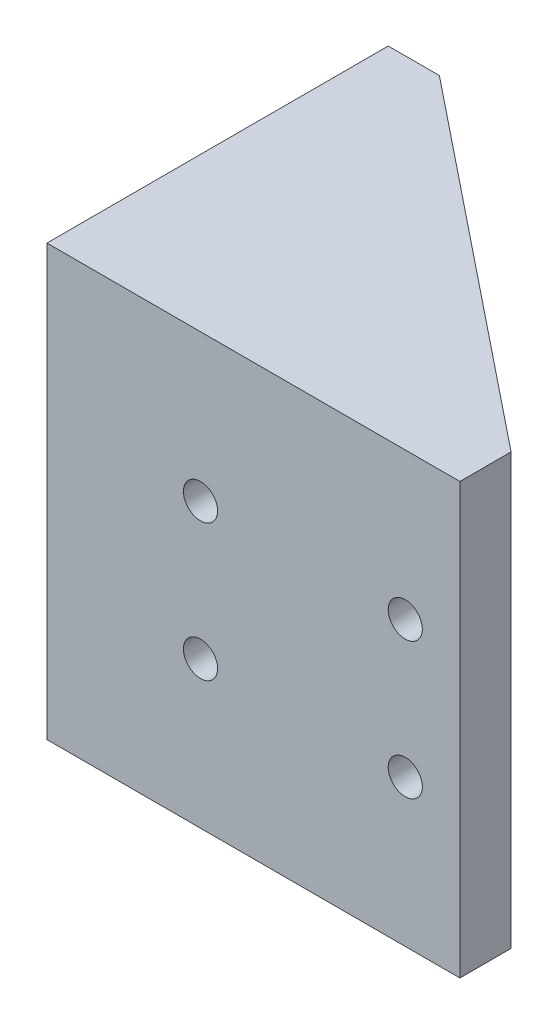
from build123d import *

# Parameters (mm, degrees)
EXTRUDE_1_DEPTH     = 12.6
SKETCH_2_W          = 21.2
SKETCH_2_H          = 20.2
CUT_EXTRUDE_1_DEPTH = 17
SKETCH_3_R          = 1
CUT_EXTRUDE_2_DEPTH = 34.828981658
SKETCH_4_R          = 1.6
CUT_EXTRUDE_3_DEPTH = 32.75216528
FILLET_1_R          = 5
CUT_EXTRUDE_4_DEPTH = 17


with BuildPart() as part:
    # 草图1 → 凸台-拉伸1 (new, symmetric)
    with BuildSketch(Plane(origin=(0, 0, 0), x_dir=(1, 0, 0), z_dir=(0, 1, 0))):
        Polygon((0, 0), (24.2, 0), (24.2, 3), (3, 20), (0, 20), align=None)
    extrude(amount=EXTRUDE_1_DEPTH, both=True)

    # 草图2 → 切除-拉伸1 (cut)
    with BuildSketch(Plane(origin=(0, 0, -20), x_dir=(-1, 0, 0), z_dir=(0, 0, -1))):
        with Locations((-13.6, 0)):
            Rectangle(SKETCH_2_W, SKETCH_2_H)
    extrude(amount=-CUT_EXTRUDE_1_DEPTH, mode=Mode.SUBTRACT)

    # 草图3 → 切除-拉伸2 (cut, through all)
    with BuildSketch(Plane.XY):
        with Locations((21, -4)):
            Circle(SKETCH_3_R)
        with Locations(Location((21, 4, 0), (0, 0, 180))):
            Circle(SKETCH_3_R)
        with Locations((9, 4)):
            Circle(SKETCH_3_R)
        with Locations(Location((9, -4, 0), (0, 0, 180))):
            Circle(SKETCH_3_R)
    extrude(amount=-CUT_EXTRUDE_2_DEPTH, mode=Mode.SUBTRACT)

    # 草图4 → 切除-拉伸3 (cut, through all)
    with BuildSketch(Plane(origin=(3, 0, 0), x_dir=(0, 0, -1), z_dir=(1, 0, 0))):
        with Locations(Location((16, 7, 0), (0, 0, 90))):
            Circle(SKETCH_4_R)
        with Locations(Location((16, -7, 0), (0, 0, 270))):
            Circle(SKETCH_4_R)
    extrude(amount=-CUT_EXTRUDE_3_DEPTH, mode=Mode.SUBTRACT)

    # 圆角1
    fillet_1_edges = [part.edges().sort_by_distance(p)[0] for p in [
        (13.6, -10.1, -3),
        (13.6, 10.1, -3),
    ]]
    fillet(fillet_1_edges, radius=FILLET_1_R)

    # 草图6 → 切除-拉伸4 (cut)
    with BuildSketch(Plane(origin=(0, 0, -20), x_dir=(-1, 0, 0), z_dir=(0, 0, -1))):
        with BuildLine():
            Line((-3, -5.1), (-3, 5.1))
            ThreePointArc((-3, 5.1), (-4.464466094, 8.635533906), (-8, 10.1))
            Line((-8, 10.1), (-24.2, 10.1))
            Line((-24.2, 10.1), (-24.2, -10.1))
            Line((-24.2, -10.1), (-8, -10.1))
            ThreePointArc((-8, -10.1), (-4.464466094, -8.635533906), (-3, -5.1))
        make_face()
    extrude(amount=-CUT_EXTRUDE_4_DEPTH, mode=Mode.SUBTRACT)


solid = part.part
